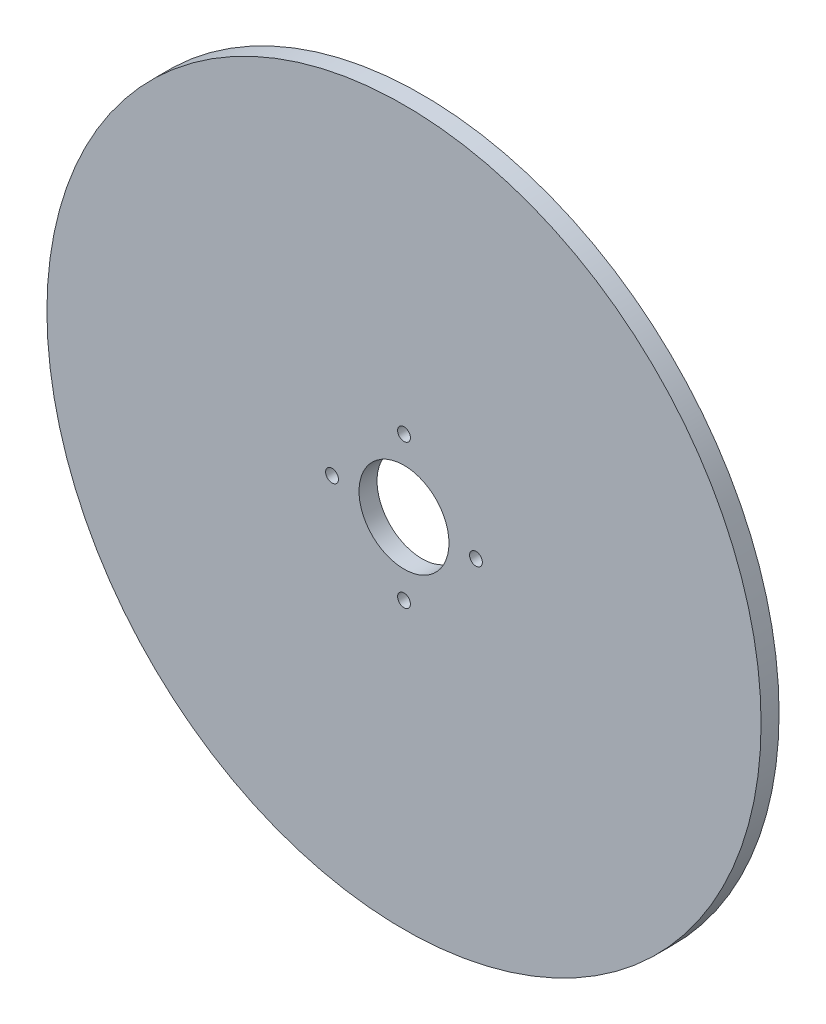
from build123d import *

# Parameters (mm, degrees)
SKETCH1_R                     = 63.0174
SKETCH1_R_2                   = 7.9375
BOSS_EXTRUDE1_DEPTH           = 3.175
TAP_DRILL_FOR_4_40_TAP1_D     = 2.2606
TAP_DRILL_FOR_4_40_TAP1_DEPTH = 4
TAP_DRILL_FOR_4_40_TAP1_TIP   = 0.679152758


with BuildPart() as part:
    # Sketch1 → Boss-Extrude1 (new body)
    with BuildSketch(Plane.XY):
        Circle(SKETCH1_R)
        Circle(SKETCH1_R_2, mode=Mode.SUBTRACT)
    extrude(amount=BOSS_EXTRUDE1_DEPTH)

    # Tap Drill for #4-40 Tap1
    with Locations(Plane.XY.offset(3.175)):
        with Locations((0, 12.7), (0, -12.7), (12.7, 0), (-12.7, 0)):
            Hole(TAP_DRILL_FOR_4_40_TAP1_D / 2, depth=TAP_DRILL_FOR_4_40_TAP1_DEPTH)
            with Locations((0, 0, -(TAP_DRILL_FOR_4_40_TAP1_DEPTH + TAP_DRILL_FOR_4_40_TAP1_TIP / 2))):  # 118° drill point
                Cone(0, TAP_DRILL_FOR_4_40_TAP1_D / 2, TAP_DRILL_FOR_4_40_TAP1_TIP, mode=Mode.SUBTRACT)


solid = part.part
